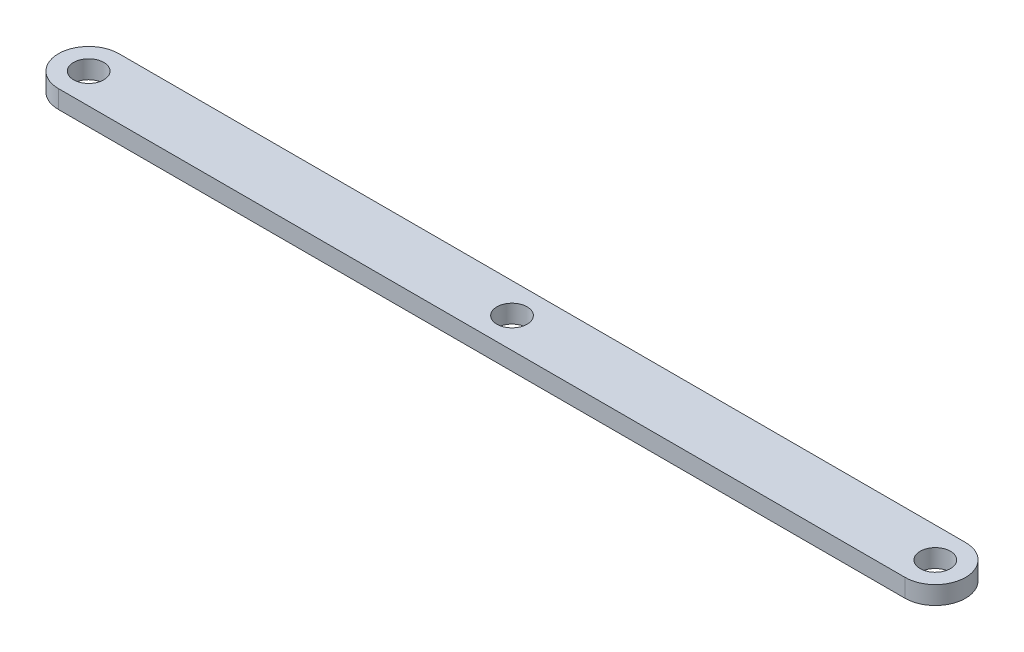
from build123d import *

# Parameters (mm, degrees)
SKETCH1_R           = 2.5
BOSS_EXTRUDE1_DEPTH = 3


with BuildPart() as part:
    # Sketch1 → Boss-Extrude1 (new body)
    with BuildSketch(Plane(origin=(0, 0, 0), x_dir=(1, 0, 0), z_dir=(0, 1, 0))):
        with BuildLine():
            Line((0, 5), (140, 5))
            ThreePointArc((140, 5), (145, 0), (140, -5))
            Line((140, -5), (0, -5))
            ThreePointArc((0, -5), (-5, 0), (0, 5))
        make_face()
        with Locations(Location((0, 0, 0), (0, 0, 270))):
            Circle(SKETCH1_R, mode=Mode.SUBTRACT)
        with Locations(Location((140, 0, 0), (0, 0, 270))):
            Circle(SKETCH1_R, mode=Mode.SUBTRACT)
        with Locations(Location((70, 0, 0), (0, 0, 270))):
            Circle(SKETCH1_R, mode=Mode.SUBTRACT)
    extrude(amount=BOSS_EXTRUDE1_DEPTH)


solid = part.part
